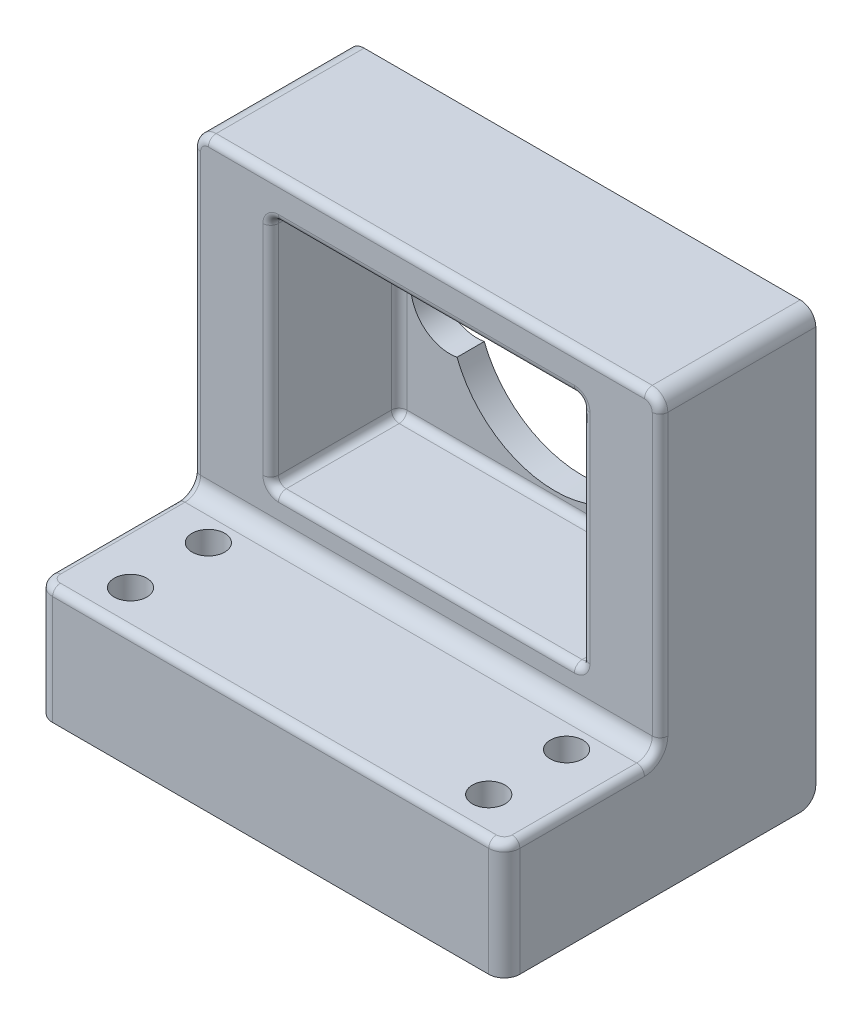
from build123d import *

# Parameters (mm, degrees)
SKETCH1_W               = 60
SKETCH1_H               = 40
BOSS_EXTRUDE1_DEPTH     = 20
CUT_EXTRUDE1_DEPTH      = 30
SKETCH3_W               = 60
SKETCH3_H               = 15
BOSS_EXTRUDE2_DEPTH     = 40
SKETCH4_R               = 2.1
CUT_EXTRUDE2_DEPTH      = 20
FILLET1_R               = 2
FILLET2_R               = 2
ESQUISSE1_W             = 40
ESQUISSE1_H             = 30
ENL_V_MAT_EXTRU_1_DEPTH = 16.5
CONG_1_R                = 1


with BuildPart() as part:
    # Sketch1 → Boss-Extrude1 (new body)
    with BuildSketch(Plane.XY):
        with Locations((5, -2.5)):
            Rectangle(SKETCH1_W, SKETCH1_H)
    extrude(amount=BOSS_EXTRUDE1_DEPTH)

    # Sketch2 → Cut-Extrude1 (cut)
    with BuildSketch(Plane.XY.offset(20)):
        with BuildLine():
            ThreePointArc((-7.574074074, -7.413518208), (5, -16), (17.574074074, -7.413518208))
            ThreePointArc((17.574074074, -7.413518208), (23.5, -2.5), (17.574074074, 2.413518208))
            ThreePointArc((17.574074074, 2.413518208), (5, 11), (-7.574074074, 2.413518208))
            ThreePointArc((-7.574074074, 2.413518208), (-13.5, -2.5), (-7.574074074, -7.413518208))
        make_face()
    extrude(amount=-CUT_EXTRUDE1_DEPTH, mode=Mode.SUBTRACT)

    # Sketch3 → Boss-Extrude2 (add)
    with BuildSketch(Plane(origin=(0, 0, 0), x_dir=(-1, 0, 0), z_dir=(0, 0, -1))):
        with Locations((-5, -30)):
            Rectangle(SKETCH3_W, SKETCH3_H)
    extrude(amount=-BOSS_EXTRUDE2_DEPTH)

    # Sketch4 → Cut-Extrude2 (cut)
    with BuildSketch(Plane(origin=(0, -22.5, 0), x_dir=(1, 0, 0), z_dir=(0, 1, 0))):
        with Locations(Location((-18, -35, 0), (0, 0, 180))):
            Circle(SKETCH4_R)
        with Locations(Location((-18, -25, 0), (0, 0, 180))):
            Circle(SKETCH4_R)
        with Locations(Location((28, -35, 0), (0, 0, 180))):
            Circle(SKETCH4_R)
        with Locations(Location((28, -25, 0), (0, 0, 180))):
            Circle(SKETCH4_R)
    extrude(amount=-CUT_EXTRUDE2_DEPTH, mode=Mode.SUBTRACT)

    # Fillet1
    fillet1_edges = [part.edges().sort_by_distance(p)[0] for p in [
        (5, -22.5, 20),
    ]]
    fillet(fillet1_edges, radius=FILLET1_R)

    # Fillet2
    fillet2_edges = [part.edges().sort_by_distance(p)[0] for p in [
        (35, -30, 40),
        (-25, -30, 40),
        (5, -37.5, 0),
        (-25, 17.5, 10),
        (35, 17.5, 10),
    ]]
    fillet(fillet2_edges, radius=FILLET2_R)

    # Esquisse1 → Enlèv. mat.-Extru.1 (cut)
    with BuildSketch(Plane.XY.offset(20)):
        with Locations((5, -2.5)):
            Rectangle(ESQUISSE1_W, ESQUISSE1_H)
    extrude(amount=-ENL_V_MAT_EXTRU_1_DEPTH, mode=Mode.SUBTRACT)

    # Congé1
    cong_1_edges = [part.edges().sort_by_distance(p)[0] for p in [
        (-15, -2.5, 20),
        (5, -17.5, 20),
        (25, -2.5, 20),
        (5, 12.5, 20),
        (-15, -2.5, 3.5),
        (-15, -17.5, 11.75),
        (5, 12.5, 3.5),
        (-15, 12.5, 11.75),
        (25, -2.5, 3.5),
        (25, 12.5, 11.75),
        (5, -17.5, 3.5),
        (25, -17.5, 11.75),
        (35, -2.5, 20),
        (35, -21.914213562, 20.585786438),
        (-25, -21.914213562, 20.585786438),
        (-25, -22.5, 30),
        (-25, -2.5, 20),
        (35, -22.5, 30),
        (5, -22.5, 40),
        (-24.414213562, -22.5, 39.414213562),
        (34.414213562, -22.5, 39.414213562),
        (5, 17.5, 20),
        (34.414213562, 16.914213562, 20),
        (-24.414213562, 16.914213562, 20),
    ]]
    fillet(cong_1_edges, radius=CONG_1_R)


solid = part.part
